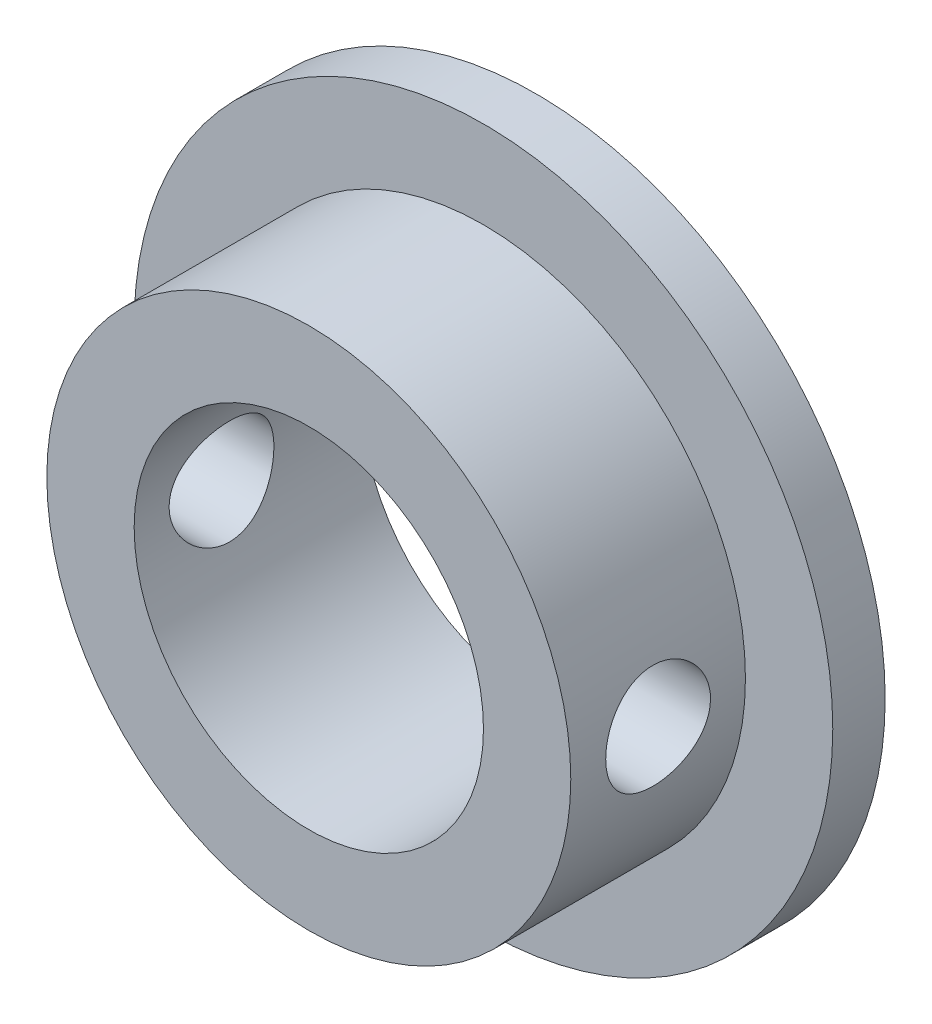
from build123d import *

# Parameters (mm, degrees)
SKETCH_1_R          = 10
EXTRUDE_1_DEPTH     = 1.5
SKETCH_2_R          = 7.5
EXTRUDE_2_DEPTH     = 5
SKETCH_3_R          = 5
CUT_EXTRUDE_1_DEPTH = 16.564382416
SKETCH_4_R          = 1.5
CUT_EXTRUDE_2_DEPTH = 22.177818585


with BuildPart() as part:
    # 草图1 → 凸台-拉伸1 (new body)
    with BuildSketch(Plane.XY):
        Circle(SKETCH_1_R)
    extrude(amount=EXTRUDE_1_DEPTH)

    # 草图2 → 凸台-拉伸2 (add)
    with BuildSketch(Plane.XY.offset(1.5)):
        Circle(SKETCH_2_R)
    extrude(amount=EXTRUDE_2_DEPTH)

    # 草图3 → 切除-拉伸1 (cut, through all)
    with BuildSketch(Plane.XY.offset(6.5)):
        Circle(SKETCH_3_R)
    extrude(amount=-CUT_EXTRUDE_1_DEPTH, mode=Mode.SUBTRACT)

    # 草图4 → 切除-拉伸2 (cut, through all)
    with BuildSketch(Plane(origin=(7.5, 0, 0), x_dir=(0, 0, -1), z_dir=(1, 0, 0))):
        with Locations((-4, 0)):
            Circle(SKETCH_4_R)
    extrude(amount=-CUT_EXTRUDE_2_DEPTH, mode=Mode.SUBTRACT)


solid = part.part
